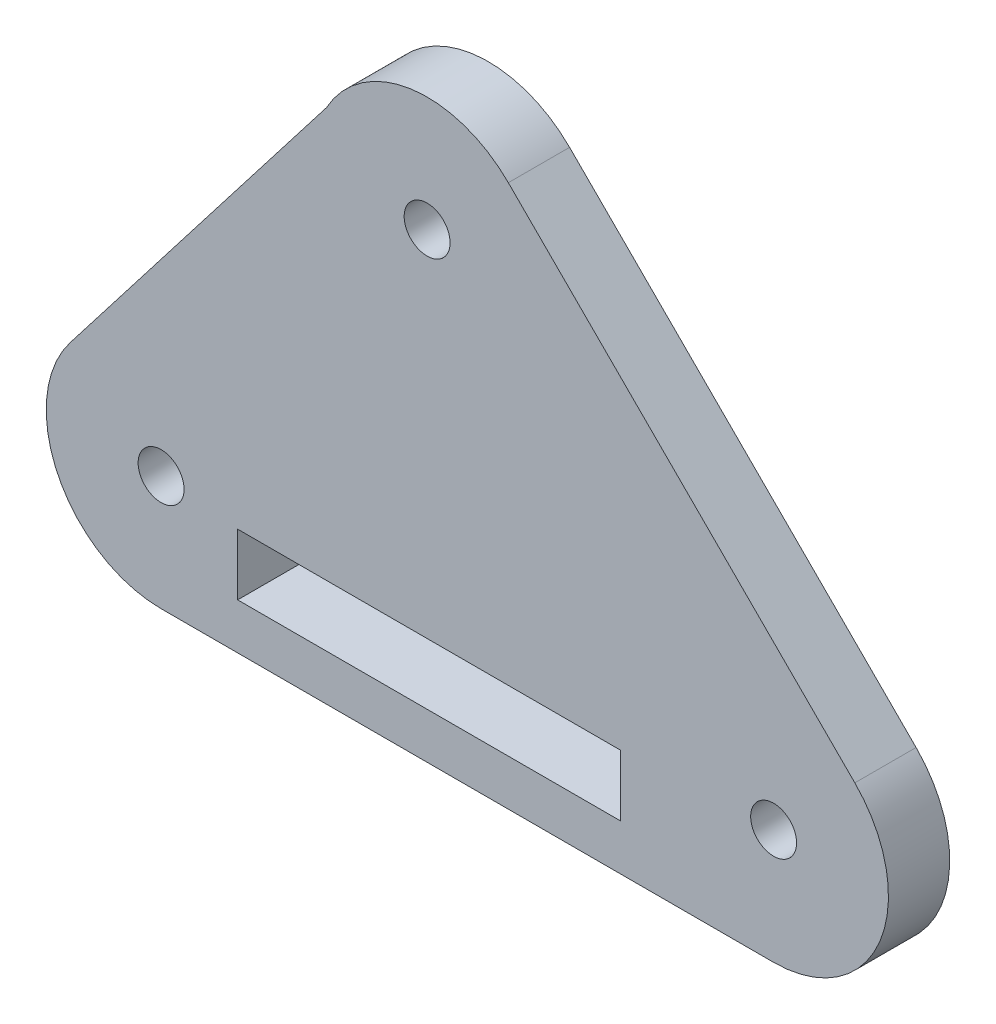
from build123d import *

# Parameters (mm, degrees)
SCHIZZO1_R                   = 1.5
SCHIZZO1_W                   = 25
SCHIZZO1_H                   = 4
ESTRUSIONE_ESTRUSIONE2_DEPTH = 4


with BuildPart() as part:
    # Schizzo1 → Estrusione-Estrusione2 (new body)
    with BuildSketch(Plane.XY):
        with BuildLine():
            Line((-22.627416998, -7.5), (0, -7.5))
            ThreePointArc((0, -7.5), (6.929096494, -2.870125743), (5.303300859, 5.303300859))
            Line((5.303300859, 5.303300859), (-17.324116139, 27.930717857))
            ThreePointArc((-17.324116139, 27.930717857), (-23.686333927, 30.052287026), (-29.20181593, 26.236749163))
            Line((-29.20181593, 26.236749163), (-45.934294533, 4.586300077))
            ThreePointArc((-45.934294533, 4.586300077), (-46.732282324, -3.305506726), (-40, -7.5))
            Line((-40, -7.5), (-22.627416998, -7.5))
        make_face()
        Circle(SCHIZZO1_R, mode=Mode.SUBTRACT)
        with Locations((-22.627416998, 22.627416998)):
            Circle(SCHIZZO1_R, mode=Mode.SUBTRACT)
        with Locations((-40, 0)):
            Circle(SCHIZZO1_R, mode=Mode.SUBTRACT)
        with Locations((-22.5, -2.5)):
            Rectangle(SCHIZZO1_W, SCHIZZO1_H, mode=Mode.SUBTRACT)
    extrude(amount=ESTRUSIONE_ESTRUSIONE2_DEPTH)


solid = part.part
